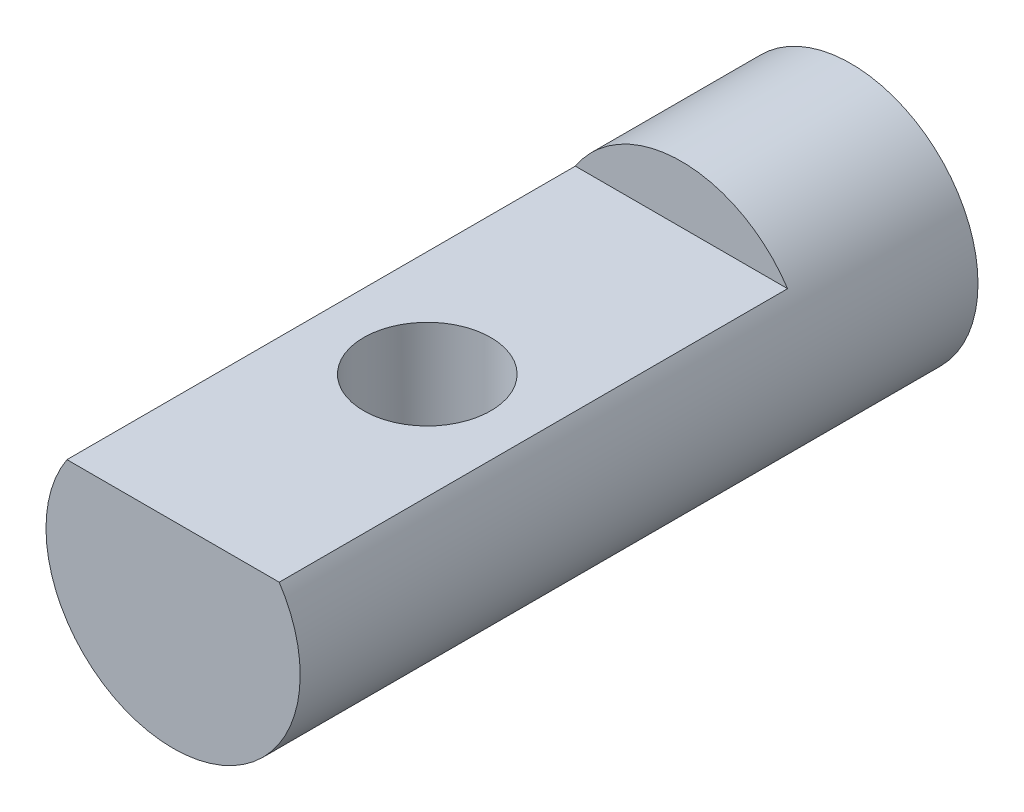
from build123d import *

# Parameters (mm, degrees)
SKETCH1_R           = 3
BOSS_EXTRUDE1_DEPTH = 16
CUT_EXTRUDE1_START  = -12
CUT_EXTRUDE1_DEPTH  = 12
SKETCH3_R           = 1.5
CUT_EXTRUDE2_DEPTH  = 12


with BuildPart() as part:
    # Sketch1 → Boss-Extrude1 (new body)
    with BuildSketch(Plane.XY):
        Circle(SKETCH1_R)
    extrude(amount=BOSS_EXTRUDE1_DEPTH)

    # Sketch2 → Cut-Extrude1 (cut)
    with BuildSketch(Plane.XY.offset(16).offset(CUT_EXTRUDE1_START)):
        with BuildLine():
            Line((-2.505493963, 1.65), (2.505493963, 1.65))
            ThreePointArc((2.505493963, 1.65), (0, 3), (-2.505493963, 1.65))
        make_face()
    extrude(amount=CUT_EXTRUDE1_DEPTH, mode=Mode.SUBTRACT)

    # Sketch3 → Cut-Extrude2 (cut)
    with BuildSketch(Plane(origin=(0, 1.65, 0), x_dir=(1, 0, 0), z_dir=(0, 1, 0))):
        with Locations(Location((0, -10, 0), (0, 0, 180))):
            Circle(SKETCH3_R)
    extrude(amount=-CUT_EXTRUDE2_DEPTH, mode=Mode.SUBTRACT)


solid = part.part
